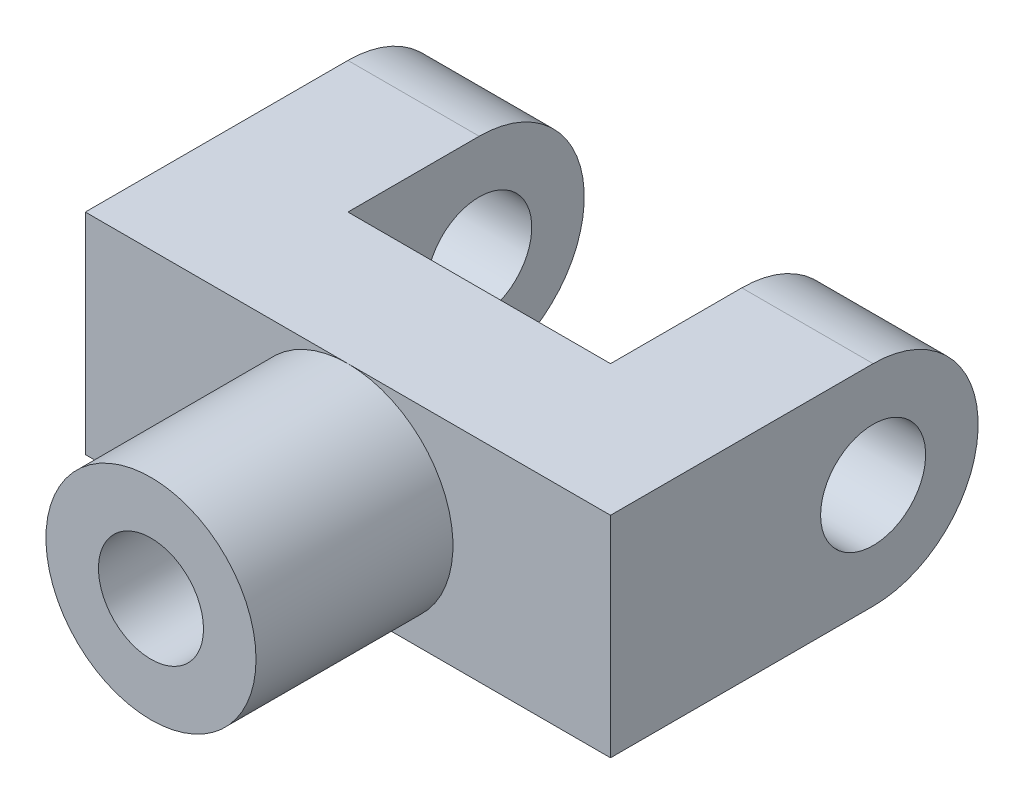
from build123d import *

# Parameters (mm, degrees)
SKETCH1_R           = 4
SKETCH1_R_2         = 2
BOSS_EXTRUDE1_DEPTH = 2.5
SKETCH1_3_R         = 4
SKETCH1_3_R_2       = 2
BOSS_EXTRUDE2_DEPTH = 10
BOSS_EXTRUDE3_DEPTH = 5


with BuildPart() as part:
    # Sketch1 → Boss-Extrude1 (new, symmetric)
    # profile 1 of 4: a face of its own
    with BuildSketch(Plane.XY):
        with BuildLine():
            Line((10, 4), (0, 4))
            ThreePointArc((0, 4), (2.828427125, 2.828427125), (4, 0))
            ThreePointArc((4, 0), (2.828427125, -2.828427125), (0, -4))
            Line((0, -4), (10, -4))
            Line((10, -4), (10, 4))
        make_face()
    # profile 2 of 4: a face of its own
    with BuildSketch(Plane.XY):
        with BuildLine():
            Line((0, 4), (-10, 4))
            Line((-10, 4), (-10, -4))
            Line((-10, -4), (0, -4))
            ThreePointArc((0, -4), (-4, 0), (0, 4))
        make_face()
    # profile 3 of 4: a face of its own
    with BuildSketch(Plane.XY):
        Circle(SKETCH1_R)
        Circle(SKETCH1_R_2, mode=Mode.SUBTRACT)
    # profile 4 of 4: a face of its own
    with BuildSketch(Plane.XY):
        Circle(SKETCH1_R_2)
    extrude(amount=BOSS_EXTRUDE1_DEPTH, both=True)

    # Sketch1<3> → Boss-Extrude2 (add)
    with BuildSketch(Plane.XY):
        with Locations(Location((0, 0, 0), (0, 0, 270))):
            Circle(SKETCH1_3_R)
        Circle(SKETCH1_3_R_2, mode=Mode.SUBTRACT)
    extrude(amount=BOSS_EXTRUDE2_DEPTH)

    # Sketch2 → Boss-Extrude3 (add)
    with BuildSketch(Plane.ZY.offset(10)):
        with BuildLine():
            Line((-2.5, -4), (-2.5, 4))
            Line((-2.5, 4), (-7.5, 4))
            ThreePointArc((-7.5, 4), (-4.671572875, 2.828427125), (-3.5, 0))
            ThreePointArc((-3.5, 0), (-4.671572875, -2.828427125), (-7.5, -4))
            Line((-7.5, -4), (-2.5, -4))
        make_face()
        with BuildLine():
            ThreePointArc((-3.5, 0), (-4.671572875, 2.828427125), (-7.5, 4))
            Line((-7.5, 4), (-7.5, 2))
            ThreePointArc((-7.5, 2), (-6.085786438, 1.414213562), (-5.5, 0))
            ThreePointArc((-5.5, 0), (-6.085786438, -1.414213562), (-7.5, -2))
            Line((-7.5, -2), (-7.5, -4))
            ThreePointArc((-7.5, -4), (-4.671572875, -2.828427125), (-3.5, 0))
        make_face()
        with BuildLine():
            Line((-7.5, 2), (-7.5, 4))
            ThreePointArc((-7.5, 4), (-11.5, 0), (-7.5, -4))
            Line((-7.5, -4), (-7.5, -2))
            ThreePointArc((-7.5, -2), (-9.5, 0), (-7.5, 2))
        make_face()
    boss_extrude3 = extrude(amount=-BOSS_EXTRUDE3_DEPTH)

    # Mirror1: Boss-Extrude3 across plane
    add(boss_extrude3.mirror(Plane(origin=(0, 0, 0), x_dir=(0, 0, 1), z_dir=(1, 0, 0))))


solid = part.part
